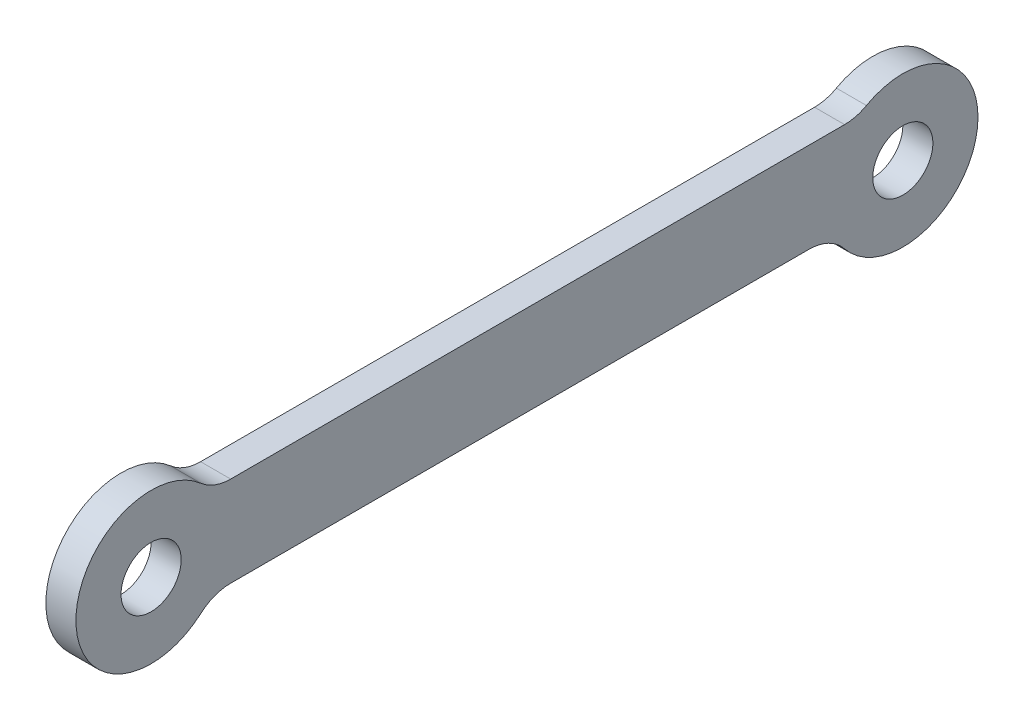
from build123d import *

# Parameters (mm, degrees)
SKETCH_1_R               = 5
SKETCH_1_W               = 50
SKETCH_1_H               = 6
EXTRUDE_1_DEPTH          = 2
CUT_EXTRUDE_2_DEPTH      = 56.362442143
CUT_EXTRUDE_2_DEPTH_BACK = 56.362442143
SKETCH_1_3_R             = 2
FILLET_1_R               = 3


with BuildPart() as part:
    # 草图1 → 凸台-拉伸1 (new body)
    with BuildSketch(Plane(origin=(0, 0, 0), x_dir=(0, 0, -1), z_dir=(1, 0, 0))):
        Circle(SKETCH_1_R)
        with Locations((50, -1)):
            Circle(SKETCH_1_R)
        with Locations((25, 0)):
            Rectangle(SKETCH_1_W, SKETCH_1_H)
    extrude(amount=EXTRUDE_1_DEPTH)

    # 草图1<3> → 切除-拉伸2 (cut, two sides: drawn at the far end of the back side and taken through both)
    with BuildSketch(Plane(origin=(0, 0, 0), x_dir=(0, 0, -1), z_dir=(1, 0, 0)).offset(-CUT_EXTRUDE_2_DEPTH_BACK)):
        Circle(SKETCH_1_3_R)
        with Locations((50, -1)):
            Circle(SKETCH_1_3_R)
    extrude(amount=CUT_EXTRUDE_2_DEPTH + CUT_EXTRUDE_2_DEPTH_BACK, mode=Mode.SUBTRACT)

    # 圆角1
    fillet_1_edges = [part.edges().sort_by_distance(p)[0] for p in [
        (1, -3, -4),
        (1, -3, -45.417424305),
        (1, 3, -47),
        (1, 3, -4),
    ]]
    fillet(fillet_1_edges, radius=FILLET_1_R)


solid = part.part
